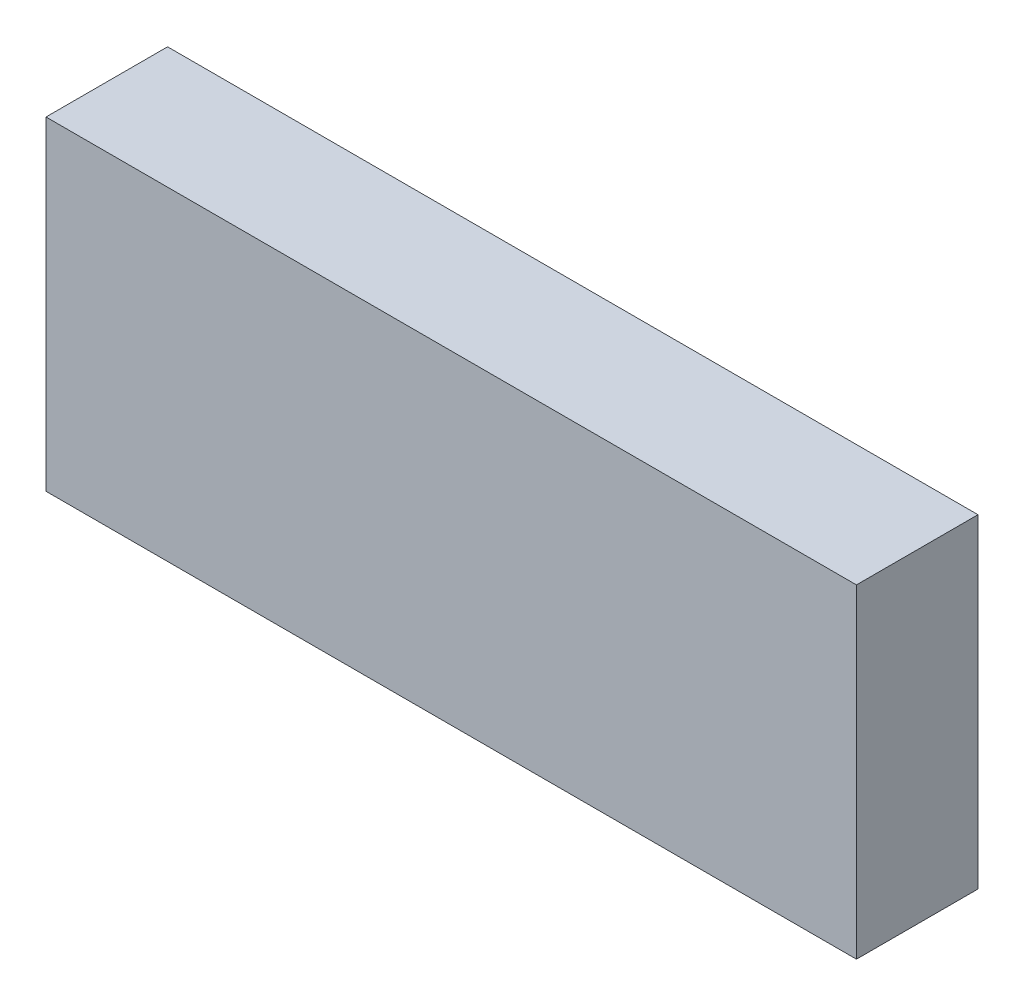
from build123d import *

# Parameters (mm, degrees)
SKETCH_1_W      = 200
SKETCH_1_H      = 80
EXTRUDE_1_DEPTH = 15


with BuildPart() as part:
    # 草图1 → 凸台-拉伸1 (new, symmetric)
    with BuildSketch(Plane.XY):
        Rectangle(SKETCH_1_W, SKETCH_1_H)
    extrude(amount=EXTRUDE_1_DEPTH, both=True)


solid = part.part
